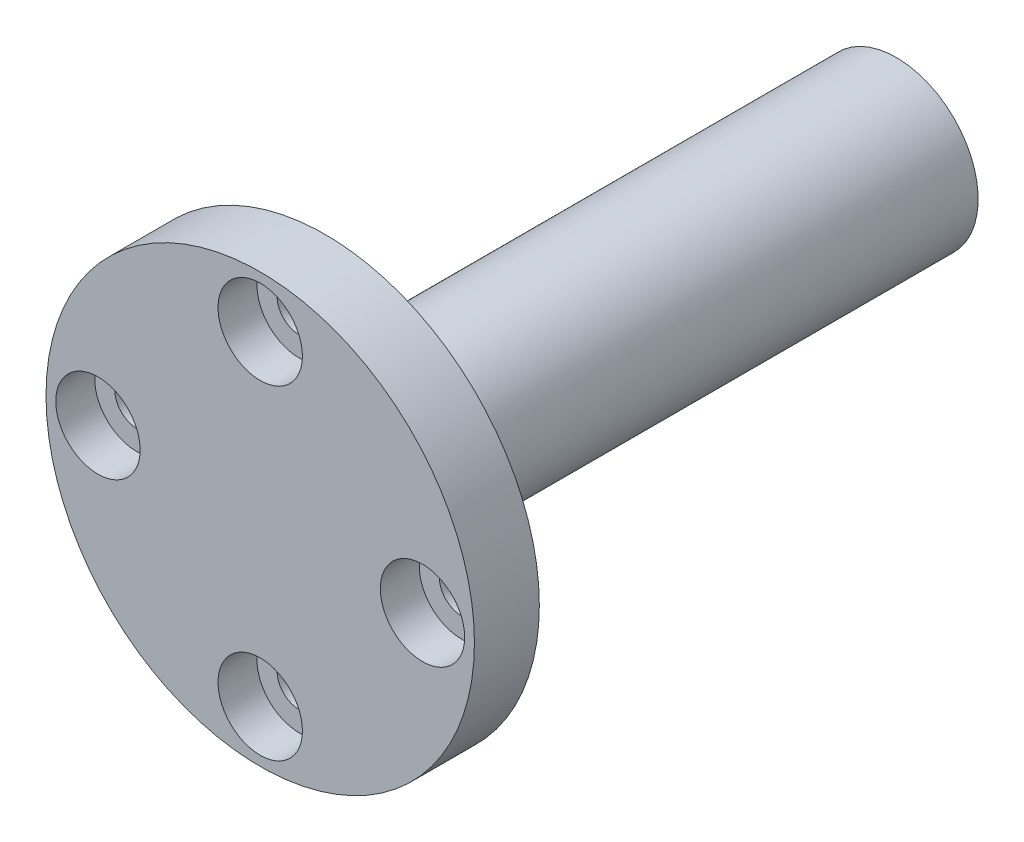
from build123d import *

# Parameters (mm, degrees)
HOLE_WIZARD_M31_D           = 3.4
HOLE_WIZARD_M31_CBORE_D     = 6.5
HOLE_WIZARD_M31_CBORE_DEPTH = 3


with BuildPart() as part:
    # Эскиз2 → Повернуть1 (revolve)
    with BuildSketch(Plane(origin=(0, 0, 0), x_dir=(0, 0, -1), z_dir=(1, 0, 0)), mode=Mode.PRIVATE) as revolve_1_sk:
        Polygon((0, 0), (0, 16.5), (5, 16.5), (5, 6.3), (49, 6.3), (49, 0), align=None)
    revolve(revolve_1_sk.sketch.rotate(Axis((0, 0, -49), (0, 0, 1)), 90), axis=Axis((0, 0, -49), (0, 0, 1)))

    # Цековка для винта с внутренним шестигранником M31 (through all)
    with Locations(Plane.XY):
        with Locations((-12.5, 0), (0, 12.5), (12.5, 0), (0, -12.5)):
            CounterBoreHole(HOLE_WIZARD_M31_D / 2, HOLE_WIZARD_M31_CBORE_D / 2, HOLE_WIZARD_M31_CBORE_DEPTH)


solid = part.part
